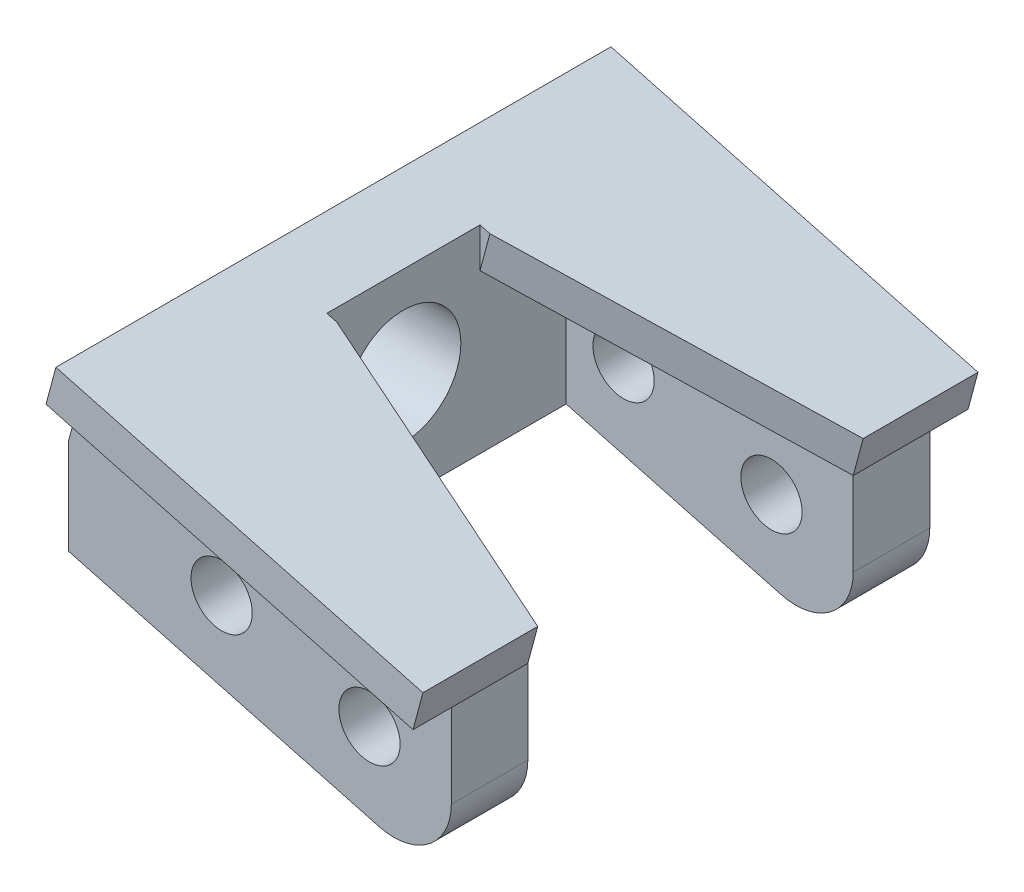
from build123d import *

# Parameters (mm, degrees)
SKETCH_1_W          = 25
SKETCH_1_H          = 11
EXTRUDE_1_DEPTH     = 5
SKETCH_2_W          = 4
SKETCH_2_H          = 15
EXTRUDE_2_DEPTH     = 15
SKETCH_4_R          = 1.6
CUT_EXTRUDE_1_DEPTH = 34.395358959
EXTRUDE_3_DEPTH     = 2
CUT_EXTRUDE_2_DEPTH = 37.4451986
SKETCH_8_R          = 3
CUT_EXTRUDE_3_DEPTH = 23.744804244
SKETCH_9_W          = 8
SKETCH_9_H          = 6.263890715
CUT_EXTRUDE_4_DEPTH = 23.744804244
FILLET_1_R          = 3


with BuildPart() as part:
    # 草图1 → 凸台-拉伸1 (new body)
    with BuildSketch(Plane(origin=(0, 0, 0), x_dir=(0, 0, -1), z_dir=(1, 0, 0))):
        Rectangle(SKETCH_1_W, SKETCH_1_H)
    extrude(amount=EXTRUDE_1_DEPTH)

    # 草图2 → 凸台-拉伸2 (add)
    with BuildSketch(Plane(origin=(5, 0, 0), x_dir=(0, 0, -1), z_dir=(1, 0, 0))):
        with Locations((-10.5, -2)):
            Rectangle(SKETCH_2_W, SKETCH_2_H)
        with Locations((10.5, -2)):
            Rectangle(SKETCH_2_W, SKETCH_2_H)
    extrude(amount=EXTRUDE_2_DEPTH)

    # 草图4 → 切除-拉伸1 (cut, through all)
    with BuildSketch(Plane.XY.offset(12.5)):
        with Locations((15.72740661, -2.855250622)):
            Circle(SKETCH_4_R)
        with Locations((8, -0.784698261)):
            Circle(SKETCH_4_R)
        Polygon((0, 5.5), (20, 0.141016151), (20, 5.5), align=None)
        Polygon((0, -2.782209443), (20, -8.141193292), (20, -9.5), (0, -9.5), align=None)
    extrude(amount=-CUT_EXTRUDE_1_DEPTH, mode=Mode.SUBTRACT)

    # 草图6 → 凸台-拉伸3 (add)
    with BuildSketch(Plane(origin=(1.375, 5.13156986, 0), x_dir=(0.96592582628907, -0.25881904510251436, 0), z_dir=(0.25881904510251436, 0.96592582628907, 0))):
        Polygon((19.28201886, 8.5), (19.28201886, 14.5), (-1.423504748, 14.5), (-1.423504748, -14.5), (19.28201886, -14.5), (19.28201886, -8.5), (3.752876154, -4), (3.752876154, 4), align=None)
    extrude(amount=EXTRUDE_3_DEPTH)

    # 草图7 → 切除-拉伸2 (cut, through all)
    with BuildSketch(Plane.XY.offset(14.5)):
        Polygon((1.342544747, 7.21081858), (0, 2.200373372), (-7.179719812, 0.653741147), (-4.482102144, 8.771528011), align=None)
    extrude(amount=-CUT_EXTRUDE_2_DEPTH, mode=Mode.SUBTRACT)

    # 草图8 → 切除-拉伸3 (cut, through all)
    with BuildSketch(Plane(origin=(5, 0, 0), x_dir=(0, 0, -1), z_dir=(1, 0, 0))):
        with Locations(Location((0, 1.378044595, 0), (0, 0, 15.908958728))):
            Circle(SKETCH_8_R)
    extrude(amount=-CUT_EXTRUDE_3_DEPTH, mode=Mode.SUBTRACT)

    # 草图9 → 切除-拉伸4 (cut, through all)
    with BuildSketch(Plane(origin=(5, 0, 0), x_dir=(0, 0, -1), z_dir=(1, 0, 0))):
        with Locations((0, 3.617975326)):
            Rectangle(SKETCH_9_W, SKETCH_9_H)
    extrude(amount=CUT_EXTRUDE_4_DEPTH, mode=Mode.SUBTRACT)

    # 圆角1
    fillet_1_edges = [part.edges().sort_by_distance(p)[0] for p in [
        (20, -8.141193292, 10.5),
        (20, -8.141193292, -10.5),
    ]]
    fillet(fillet_1_edges, radius=FILLET_1_R)


solid = part.part
